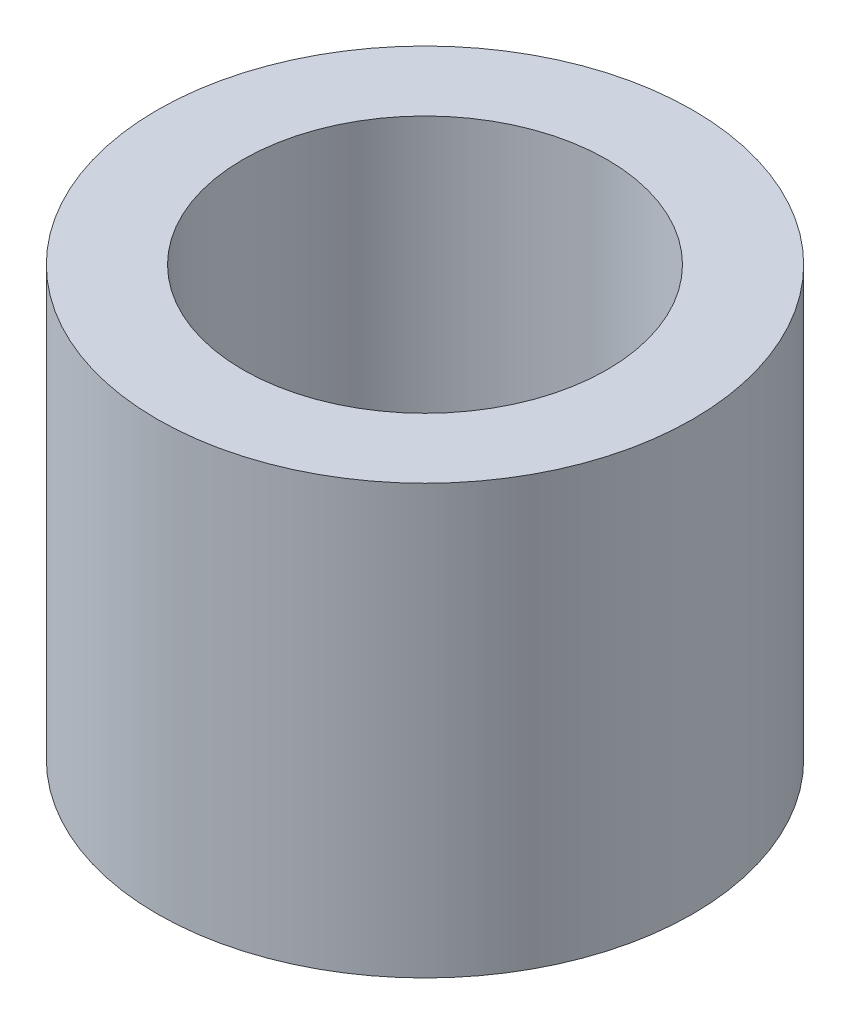
from build123d import *

# Parameters (mm, degrees)
SKETCH_1_R      = 2.5
SKETCH_1_R_2    = 1.7
EXTRUDE_1_DEPTH = 4


with BuildPart() as part:
    # Эскиз1 → Бобышка-Вытянуть1 (new body)
    with BuildSketch(Plane(origin=(0, 0, 0), x_dir=(1, 0, 0), z_dir=(0, 1, 0))):
        with Locations(Location((0, 0, 0), (0, 0, 270))):
            Circle(SKETCH_1_R)
        with Locations(Location((0, 0, 0), (0, 0, 270))):
            Circle(SKETCH_1_R_2, mode=Mode.SUBTRACT)
    extrude(amount=EXTRUDE_1_DEPTH)


solid = part.part
